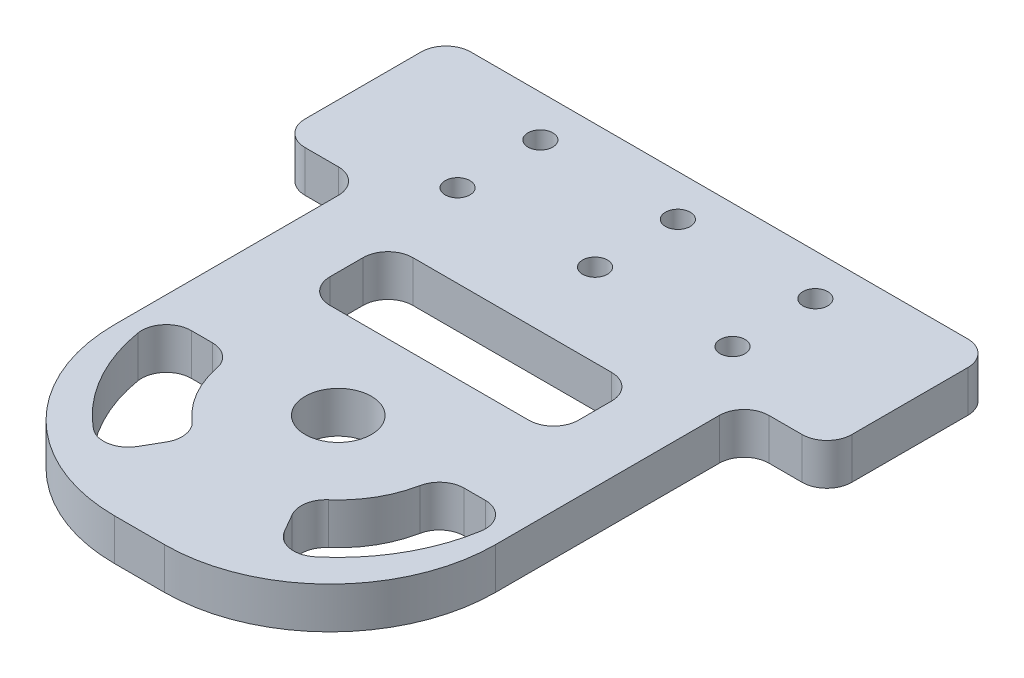
from build123d import *

# Parameters (mm, degrees)
SKETCH_1_W          = 46
SKETCH_1_H          = 70
EXTRUDE_1_DEPTH     = 5
SKETCH_2_R          = 4
CUT_EXTRUDE_1_DEPTH = 43.178193418
FILLET_1_R          = 20
CUT_EXTRUDE_4_DEPTH = 43.178193418
FILLET_3_R          = 3
SKETCH_8_W          = 20
SKETCH_8_H          = 5
EXTRUDE_2_DEPTH     = 10
SKETCH_9_W          = 20
SKETCH_9_H          = 5
EXTRUDE_3_DEPTH     = 10
FILLET_6_R          = 3
SKETCH_10_R         = 1.5
CUT_EXTRUDE_5_DEPTH = 49.363209157
SKETCH_11_W         = 30
SKETCH_11_H         = 10
CUT_EXTRUDE_6_DEPTH = 49.363209157
FILLET_7_R          = 3


with BuildPart() as part:
    # 草图1 → 凸台-拉伸1 (new body)
    with BuildSketch(Plane(origin=(0, 0, 0), x_dir=(1, 0, 0), z_dir=(0, 1, 0))):
        Rectangle(SKETCH_1_W, SKETCH_1_H)
    extrude(amount=EXTRUDE_1_DEPTH)

    # 草图2 → 切除-拉伸1 (cut, through all)
    with BuildSketch(Plane.XZ):
        with Locations(Location((0, 11, 0), (0, 0, 270))):
            Circle(SKETCH_2_R)
    extrude(amount=-CUT_EXTRUDE_1_DEPTH, mode=Mode.SUBTRACT)

    # 圆角1
    fillet_1_edges = [part.edges().sort_by_distance(p)[0] for p in [
        (23, 2.5, 35),
        (-23, 2.5, 35),
    ]]
    fillet(fillet_1_edges, radius=FILLET_1_R)

    # 草图6 → 切除-拉伸4 (cut, through all)
    with BuildSketch(Plane.XZ):
        with BuildLine():
            Line((12.5, 11), (21, 11))
            ThreePointArc((21, 11), (18.186533479, 21.5), (10.5, 29.186533479))
            Line((10.5, 29.186533479), (6.25, 21.825317547))
            ThreePointArc((6.25, 21.825317547), (10.825317547, 17.25), (12.5, 11))
        make_face()
        with BuildLine():
            Line((-12.5, 11), (-21, 11))
            ThreePointArc((-21, 11), (-18.186533479, 21.5), (-10.5, 29.186533479))
            Line((-10.5, 29.186533479), (-6.25, 21.825317547))
            ThreePointArc((-6.25, 21.825317547), (-10.825317547, 17.25), (-12.5, 11))
        make_face()
    extrude(amount=-CUT_EXTRUDE_4_DEPTH, mode=Mode.SUBTRACT)

    # 圆角3
    fillet_3_edges = [part.edges().sort_by_distance(p)[0] for p in [
        (-6.25, 2.5, 21.825317547),
        (-12.5, 2.5, 11),
        (-21, 2.5, 11),
        (-10.5, 2.5, 29.186533479),
        (12.5, 2.5, 11),
        (6.25, 2.5, 21.825317547),
        (10.5, 2.5, 29.186533479),
        (21, 2.5, 11),
    ]]
    fillet(fillet_3_edges, radius=FILLET_3_R)

    # 草图8 → 凸台-拉伸2 (add)
    with BuildSketch(Plane(origin=(23, 0, 0), x_dir=(0, 0, -1), z_dir=(1, 0, 0))):
        with Locations((25, 2.5)):
            Rectangle(SKETCH_8_W, SKETCH_8_H)
    extrude(amount=EXTRUDE_2_DEPTH)

    # 草图9 → 凸台-拉伸3 (add)
    with BuildSketch(Plane.ZY.offset(23)):
        with Locations((-25, 2.5)):
            Rectangle(SKETCH_9_W, SKETCH_9_H)
    extrude(amount=EXTRUDE_3_DEPTH)

    # 圆角6
    fillet_6_edges = [part.edges().sort_by_distance(p)[0] for p in [
        (23, 2.5, -15),
        (33, 2.5, -35),
        (33, 2.5, -15),
        (-23, 2.5, -15),
        (-33, 2.5, -35),
        (-33, 2.5, -15),
    ]]
    fillet(fillet_6_edges, radius=FILLET_6_R)

    # 草图10 → 切除-拉伸5 (cut, through all)
    with BuildSketch(Plane(origin=(0, 5, 0), x_dir=(1, 0, 0), z_dir=(0, 1, 0))):
        with Locations(Location((-16.6, 30, 0), (0, 0, 270))):
            Circle(SKETCH_10_R)
        with Locations(Location((0, 30, 0), (0, 0, 270))):
            Circle(SKETCH_10_R)
        with Locations(Location((16.6, 30, 0), (0, 0, 270))):
            Circle(SKETCH_10_R)
        with Locations(Location((16.6, 20, 0), (0, 0, 90))):
            Circle(SKETCH_10_R)
        with Locations(Location((0, 20, 0), (0, 0, 90))):
            Circle(SKETCH_10_R)
        with Locations(Location((-16.6, 20, 0), (0, 0, 90))):
            Circle(SKETCH_10_R)
    extrude(amount=-CUT_EXTRUDE_5_DEPTH, mode=Mode.SUBTRACT)

    # 草图11 → 切除-拉伸6 (cut, through all)
    with BuildSketch(Plane(origin=(0, 5, 0), x_dir=(1, 0, 0), z_dir=(0, 1, 0))):
        with Locations((0, 5)):
            Rectangle(SKETCH_11_W, SKETCH_11_H)
    extrude(amount=-CUT_EXTRUDE_6_DEPTH, mode=Mode.SUBTRACT)

    # 圆角7
    fillet_7_edges = [part.edges().sort_by_distance(p)[0] for p in [
        (15, 2.5, -10),
        (15, 2.5, 0),
        (-15, 2.5, 0),
        (-15, 2.5, -10),
    ]]
    fillet(fillet_7_edges, radius=FILLET_7_R)


solid = part.part
